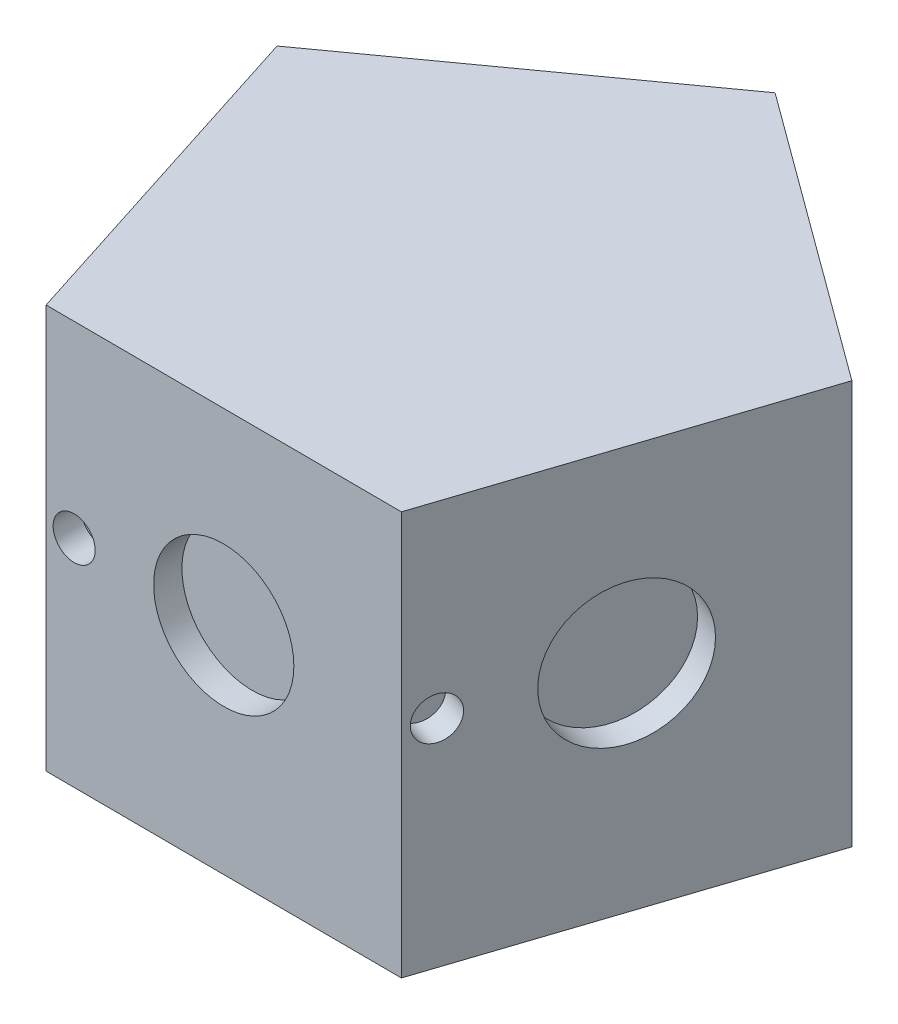
from build123d import *

# Parameters (mm, degrees)
BOSS_EXTRUDE1_DEPTH = 40
SKETCH3_R           = 7.5
SKETCH3_R_2         = 2.25
CUT_EXTRUDE1_DEPTH  = 3
SKETCH4_R           = 7.5
SKETCH4_R_2         = 2.25
CUT_EXTRUDE2_DEPTH  = 3
SKETCH5_R           = 7.5
SKETCH5_R_2         = 2.25
CUT_EXTRUDE3_DEPTH  = 3
SKETCH6_R           = 7.5
SKETCH6_R_2         = 2.25
CUT_EXTRUDE4_DEPTH  = 3
SKETCH7_R           = 7.5
SKETCH7_R_2         = 2.25
CUT_EXTRUDE5_DEPTH  = 3
BOSS_EXTRUDE2_DEPTH = 3


with BuildPart() as part:
    # Sketch2 → Boss-Extrude1 (new body)
    with BuildSketch(Plane(origin=(0, 0, 0), x_dir=(1, 0, 0), z_dir=(0, 1, 0))):
        Polygon((18.889370654, -26.231276984), (30.784563452, 9.858948677), (0.136535888, 32.32444236), (-30.700179633, 10.118655369), (-19.110290361, -26.070769422), align=None)
    extrude(amount=BOSS_EXTRUDE1_DEPTH)

    # Sketch3 → Cut-Extrude1 (cut)
    with BuildSketch(Plane(origin=(-0.110459853, 0, 26.151023203), x_dir=(0.999991079365483, 0, 0.004223883220016987), z_dir=(-0.004223883220016987, 0, 0.9999910793654831))):
        with Locations((0, 20)):
            Circle(SKETCH3_R)
        with Locations((-16, 20)):
            Circle(SKETCH3_R_2)
    extrude(amount=-CUT_EXTRUDE1_DEPTH, mode=Mode.SUBTRACT)

    # Sketch4 → Cut-Extrude2 (cut)
    with BuildSketch(Plane(origin=(24.836967053, 0, 8.186164153), x_dir=(0.3130313894077477, 0, -0.9497427805703264), z_dir=(0.9497427805703265, 0, 0.3130313894077478))):
        with Locations((0, 20)):
            Circle(SKETCH4_R)
        with Locations((-16, 20)):
            Circle(SKETCH4_R_2)
    extrude(amount=-CUT_EXTRUDE2_DEPTH, mode=Mode.SUBTRACT)

    # Sketch5 → Cut-Extrude3 (cut)
    with BuildSketch(Plane(origin=(15.46054967, 0, -21.091695519), x_dir=(-0.8065270411658909, 0, -0.591197202182312), z_dir=(0.5911972021823119, 0, -0.8065270411658908))):
        with Locations((0, 20)):
            Circle(SKETCH5_R)
        with Locations((-16, 20)):
            Circle(SKETCH5_R_2)
    extrude(amount=-CUT_EXTRUDE3_DEPTH, mode=Mode.SUBTRACT)

    # Sketch6 → Cut-Extrude4 (cut)
    with BuildSketch(Plane(origin=(-15.281821873, 0, -21.221548864), x_dir=(-0.8114925136941543, 0, 0.584362815567814), z_dir=(-0.5843628155678139, 0, -0.8114925136941542))):
        with Locations((0, 20)):
            Circle(SKETCH6_R)
        with Locations((-16, 20)):
            Circle(SKETCH6_R_2)
    extrude(amount=-CUT_EXTRUDE4_DEPTH, mode=Mode.SUBTRACT)

    # Sketch7 → Cut-Extrude5 (cut)
    with BuildSketch(Plane(origin=(-24.905234997, 0, 7.976057027), x_dir=(0.304997086086814, 0, 0.9523532839648071), z_dir=(-0.9523532839648071, 0, 0.304997086086814))):
        with Locations((0, 20)):
            Circle(SKETCH7_R)
        with Locations((-16, 20)):
            Circle(SKETCH7_R_2)
    extrude(amount=-CUT_EXTRUDE5_DEPTH, mode=Mode.SUBTRACT)

    # Sketch8 → Boss-Extrude2 (add)
    with BuildSketch(Plane.XZ):
        Polygon((30.784563452, -9.858948677), (18.889370654, 26.231276984), (-19.110290361, 26.070769422), (-30.700179633, -10.118655369), (0.136535888, -32.32444236), align=None)
    extrude(amount=BOSS_EXTRUDE2_DEPTH)


solid = part.part
